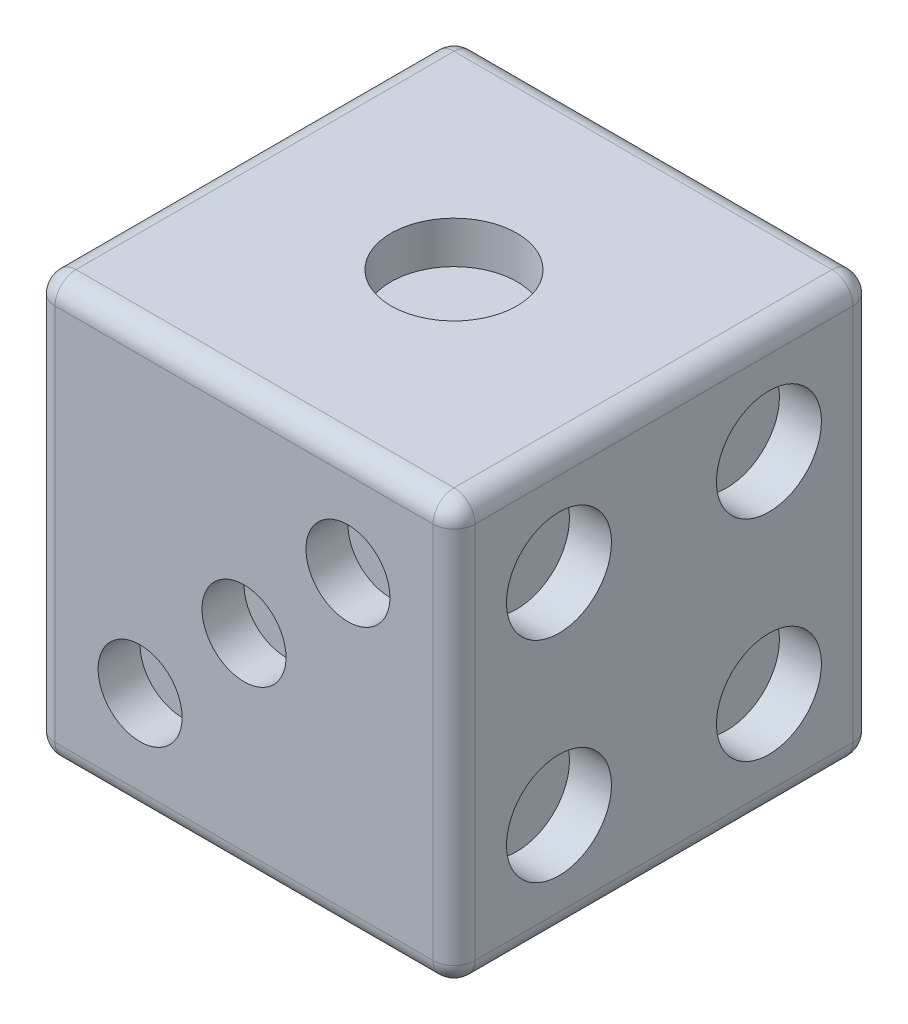
from build123d import *

# Parameters (mm, degrees)
SKETCH1_W           = 100
SKETCH1_H           = 100
BOSS_EXTRUDE1_DEPTH = 100
SKETCH3_R           = 15
CUT_EXTRUDE1_DEPTH  = 10
SKETCH5_R           = 10
CUT_EXTRUDE2_DEPTH  = 10
SKETCH8_R           = 13
CUT_EXTRUDE3_DEPTH  = 10
SKETCH12_R          = 12.5
CUT_EXTRUDE4_DEPTH  = 10
CUT_EXTRUDE5_START  = -10
SKETCH13_R          = 10
CUT_EXTRUDE5_DEPTH  = 10
SKETCH14_R          = 10
CUT_EXTRUDE6_DEPTH  = 10
FILLET6_R           = 5


with BuildPart() as part:
    # Sketch1 → Boss-Extrude1 (new body)
    with BuildSketch(Plane(origin=(0, 0, 0), x_dir=(1, 0, 0), z_dir=(0, 1, 0))):
        Rectangle(SKETCH1_W, SKETCH1_H)
    extrude(amount=BOSS_EXTRUDE1_DEPTH)

    # Sketch3 → Cut-Extrude1 (cut)
    with BuildSketch(Plane(origin=(0, 100, 0), x_dir=(1, 0, 0), z_dir=(0, 1, 0))):
        with Locations(Location((0, 0, 0), (0, 0, 270))):
            Circle(SKETCH3_R)
    extrude(amount=-CUT_EXTRUDE1_DEPTH, mode=Mode.SUBTRACT)

    # Sketch5 → Cut-Extrude2 (cut)
    with BuildSketch(Plane.XY.offset(50)):
        with Locations((0, 50)):
            Circle(SKETCH5_R)
        with Locations((24.748737342, 74.748737342)):
            Circle(SKETCH5_R)
        with Locations((-24.748737342, 25.251262658)):
            Circle(SKETCH5_R)
    extrude(amount=-CUT_EXTRUDE2_DEPTH, mode=Mode.SUBTRACT)

    # Sketch8 → Cut-Extrude3 (cut)
    with BuildSketch(Plane.ZY.offset(50)):
        with Locations((-16.970562748, 66.970562748)):
            Circle(SKETCH8_R)
        with Locations((16.970562748, 33.029437252)):
            Circle(SKETCH8_R)
    extrude(amount=-CUT_EXTRUDE3_DEPTH, mode=Mode.SUBTRACT)

    # Sketch12 → Cut-Extrude4 (cut)
    with BuildSketch(Plane(origin=(50, 0, 0), x_dir=(0, 0, -1), z_dir=(1, 0, 0))):
        with Locations((-25, 75)):
            Circle(SKETCH12_R)
        with Locations((25, 75)):
            Circle(SKETCH12_R)
        with Locations((25, 25)):
            Circle(SKETCH12_R)
        with Locations((-25, 25)):
            Circle(SKETCH12_R)
    extrude(amount=-CUT_EXTRUDE4_DEPTH, mode=Mode.SUBTRACT)

    # Sketch13 → Cut-Extrude5 (cut)
    with BuildSketch(Plane(origin=(0, 0, -50), x_dir=(-1, 0, 0), z_dir=(0, 0, -1)).offset(CUT_EXTRUDE5_START)):
        with Locations(Location((0, 50, 0), (0, 0, 180))):
            Circle(SKETCH13_R)
        with Locations((-27.5, 77.5)):
            Circle(SKETCH13_R)
        with Locations((27.5, 77.5)):
            Circle(SKETCH13_R)
        with Locations((27.5, 22.5)):
            Circle(SKETCH13_R)
        with Locations((-27.5, 22.5)):
            Circle(SKETCH13_R)
    extrude(amount=CUT_EXTRUDE5_DEPTH, mode=Mode.SUBTRACT)

    # Sketch14 → Cut-Extrude6 (cut)
    with BuildSketch(Plane(origin=(0, 0, 0), x_dir=(-1, 0, 0), z_dir=(0, -1, 0))):
        with Locations(Location((-16.67, 0, 0), (0, 0, 90))):
            Circle(SKETCH14_R)
        with Locations(Location((16.67, 0, 0), (0, 0, 90))):
            Circle(SKETCH14_R)
        with Locations(Location((16.67, 25, 0), (0, 0, 90))):
            Circle(SKETCH14_R)
        with Locations(Location((-16.67, 25, 0), (0, 0, 90))):
            Circle(SKETCH14_R)
        with Locations(Location((-16.67, -25, 0), (0, 0, 90))):
            Circle(SKETCH14_R)
        with Locations(Location((16.67, -25, 0), (0, 0, 90))):
            Circle(SKETCH14_R)
    extrude(amount=-CUT_EXTRUDE6_DEPTH, mode=Mode.SUBTRACT)

    # Fillet6
    fillet6_edges = [part.edges().sort_by_distance(p)[0] for p in [
        (0, 100, -50),
        (50, 100, 0),
        (0, 100, 50),
        (50, 0, 0),
        (0, 0, -50),
        (-50, 0, 0),
        (0, 0, 50),
        (-50, 100, 0),
        (50, 50, 50),
        (50, 50, -50),
        (-50, 50, -50),
        (-50, 50, 50),
    ]]
    fillet(fillet6_edges, radius=FILLET6_R)


solid = part.part
